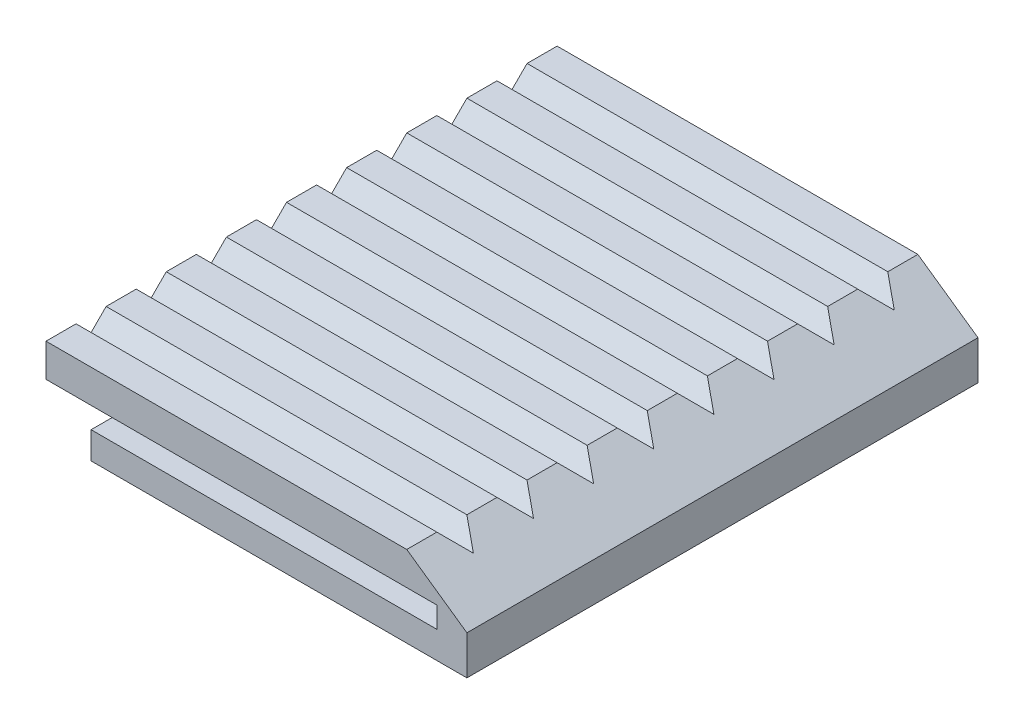
from build123d import *

# Parameters (mm, degrees)
EXTRUDE_1_DEPTH     = 17
SKETCH_4_W          = 10.5
SKETCH_4_H          = 13
CUT_EXTRUDE_1_DEPTH = 1.6
SKETCH_5_W          = 0.7
SKETCH_5_H          = 0.7
CUT_EXTRUDE_2_DEPTH = 13


with BuildPart() as part:
    # 草图1 → 凸台-拉伸1 (new body)
    with BuildSketch(Plane.XY):
        Polygon((1.5, 0.044381888), (14, 0.044381888), (14, 1.344381888), (12, 2.744381888), (0, 2.744381888), (0, 1.644381888), (1.5, 1.644381888), align=None)
    extrude(amount=EXTRUDE_1_DEPTH)

    # 草图4 → 切除-拉伸1 (cut)
    with BuildSketch(Plane.XZ.offset(-0.044381888)):
        with Locations((6.75, 8.5)):
            Rectangle(SKETCH_4_W, SKETCH_4_H)
    extrude(amount=-CUT_EXTRUDE_1_DEPTH, mode=Mode.SUBTRACT)

    # 草图5 → 切除-拉伸2 (cut)
    with BuildSketch(Plane.ZY):
        with Locations((0.35, 1.294381888)):
            Rectangle(SKETCH_5_W, SKETCH_5_H)
        Polygon((0, 2.744381888), (1, 2.744381888), (1.5, 2.244381888), (2, 2.744381888), (3, 2.744381888), (3.5, 2.244381888), (4, 2.744381888), (5, 2.744381888), (5.5, 2.244381888), (6, 2.744381888), (7, 2.744381888), (7.5, 2.244381888), (8, 2.744381888), (9, 2.744381888), (9.5, 2.244381888), (10, 2.744381888), (11, 2.744381888), (11.5, 2.244381888), (12, 2.744381888), (13, 2.744381888), (13.5, 2.244381888), (14, 2.744381888), (15, 2.744381888), (15.5, 2.244381888), (16, 2.744381888), (17, 2.744381888), (17, 3.744381888), (0, 3.744381888), align=None)
        with Locations((16.65, 1.294381888)):
            Rectangle(SKETCH_5_W, SKETCH_5_H)
    extrude(amount=-CUT_EXTRUDE_2_DEPTH, mode=Mode.SUBTRACT)


solid = part.part
